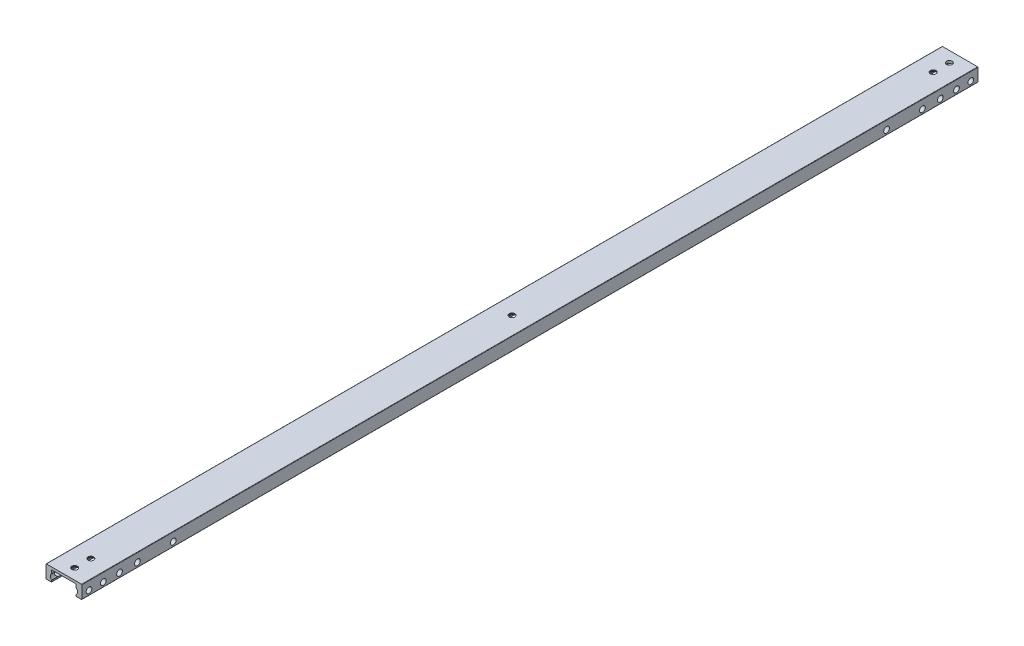
from build123d import *
from OCP.BRepFilletAPI import BRepFilletAPI_MakeChamfer

# Parameters (mm, degrees)
BOSS_EXTRUDE1_DEPTH     = 500
SKETCH4_R               = 1.6
CUT_EXTRUDE1_DEPTH      = 501.135981509
SKETCH5_R               = 1.9
CUT_EXTRUDE2_DEPTH      = 501.113677078
FILLET1_R               = 0.2
CUT_EXTRUDE3_DEPTH      = 501.297523979
CUT_EXTRUDE3_DEPTH_BACK = 501.297523979
SKETCH6_R               = 1.6
CHAMFER3_SIZE           = 1
CHAMFER3_SIZE2          = 0.965688775


with BuildPart() as part:
    # Sketch1 → Boss-Extrude1 (new body)
    with BuildSketch(Plane.XY):
        Polygon((-10, 3.7), (-10, -3.7), (-6.85, -3.7), (-6.85, 2.3), (6.85, 2.3), (6.85, -3.7), (10, -3.7), (10, 3.7), align=None)
    extrude(amount=BOSS_EXTRUDE1_DEPTH)

    # Sketch4 → Cut-Extrude1 (cut, through all)
    with BuildSketch(Plane.XZ.offset(-2.3)):
        with Locations((0, 250)):
            Circle(SKETCH4_R)
        with Locations((0, 15)):
            Circle(SKETCH4_R)
        with Locations(Location((0, 485, 0), (0, 0, 180))):
            Circle(SKETCH4_R)
        with Locations((0, 494)):
            Circle(SKETCH4_R)
        with Locations(Location((0, 6, 0), (0, 0, 180))):
            Circle(SKETCH4_R)
    extrude(amount=-CUT_EXTRUDE1_DEPTH, mode=Mode.SUBTRACT)

    # Sketch5 → Cut-Extrude2 (cut, through all)
    with BuildSketch(Plane.XY.offset(500)):
        with Locations((-5.729949702, -1.15)):
            Circle(SKETCH5_R)
        with Locations((5.729949702, -1.15)):
            Circle(SKETCH5_R)
    extrude(amount=-CUT_EXTRUDE2_DEPTH, mode=Mode.SUBTRACT)

    # Fillet1
    fillet1_edges = [part.edges().sort_by_distance(p)[0] for p in [
        (6.85, 2.3, 250),
        (-6.85, 2.3, 250),
        (-6.85, -3.7, 250),
        (-10, -3.7, 250),
        (-10, 3.7, 250),
        (10, 3.7, 250),
        (10, -3.7, 250),
        (6.85, -3.7, 250),
        (-6.85, -2.684759698, 250),
        (-6.85, 0.384759698, 250),
        (6.85, -2.684759698, 250),
        (6.85, 0.384759698, 250),
    ]]
    fillet(fillet1_edges, radius=FILLET1_R)

    # Sketch6 → Cut-Extrude3 (cut, two sides: drawn at the far end of the back side and taken through both)
    with BuildSketch(Plane(origin=(-6.85, 0, 0), x_dir=(0, 0, -1), z_dir=(1, 0, 0)).offset(-CUT_EXTRUDE3_DEPTH_BACK)):
        with Locations((-496, -1.15)):
            Circle(SKETCH6_R)
        with Locations(Location((-488, -1.15, 0), (0, 0, 67.451692584))):
            Circle(SKETCH6_R)
        with Locations((-12, -1.15)):
            Circle(SKETCH6_R)
        with Locations((-4, -1.15)):
            Circle(SKETCH6_R)
        with Locations((-469, -1.15)):
            Circle(SKETCH6_R)
        with Locations((-449, -1.15)):
            Circle(SKETCH6_R)
        with Locations((-479, -1.15)):
            Circle(SKETCH6_R)
        with Locations(Location((-51, -1.15, 0), (0, 0, 67.451692584))):
            Circle(SKETCH6_R)
        with Locations(Location((-31, -1.15, 0), (0, 0, 67.451692584))):
            Circle(SKETCH6_R)
        with Locations(Location((-21, -1.15, 0), (0, 0, 67.451692584))):
            Circle(SKETCH6_R)
    extrude(amount=CUT_EXTRUDE3_DEPTH + CUT_EXTRUDE3_DEPTH_BACK, mode=Mode.SUBTRACT)

    # Chamfer3: one chamfer whose edges measure the first distance from different faces: ONE call of the kernel's chamfer builder (chamfer() names one face for all edges)
    chamfer3_edges_1 = [part.edges().sort_by_distance(p)[0] for p in [
        (-1.6, 2.3, 15),
    ]]
    chamfer3_side_1 = [part.faces().sort_by_distance(p)[0] for p in [
        (-1.6, 3, 15),
    ]]
    chamfer3_edges_2 = [part.edges().sort_by_distance(p)[0] for p in [
        (1.6, 2.3, 485),
    ]]
    chamfer3_side_2 = [part.faces().sort_by_distance(p)[0] for p in [
        (1.6, 3, 485),
    ]]
    chamfer3_edges_3 = [part.edges().sort_by_distance(p)[0] for p in [
        (-1.6, 2.3, 494),
    ]]
    chamfer3_side_3 = [part.faces().sort_by_distance(p)[0] for p in [
        (-1.6, 3, 494),
    ]]
    chamfer3_edges_4 = [part.edges().sort_by_distance(p)[0] for p in [
        (-1.6, 2.3, 250),
    ]]
    chamfer3_side_4 = [part.faces().sort_by_distance(p)[0] for p in [
        (-1.6, 3, 250),
    ]]
    chamfer3 = BRepFilletAPI_MakeChamfer(part.part.solid().wrapped)
    for e in chamfer3_edges_1:
        chamfer3.Add(CHAMFER3_SIZE, CHAMFER3_SIZE2, e.wrapped, chamfer3_side_1[0].wrapped)  # the first distance lies on this face
    for e in chamfer3_edges_2:
        chamfer3.Add(CHAMFER3_SIZE, CHAMFER3_SIZE2, e.wrapped, chamfer3_side_2[0].wrapped)  # the first distance lies on this face
    for e in chamfer3_edges_3:
        chamfer3.Add(CHAMFER3_SIZE, CHAMFER3_SIZE2, e.wrapped, chamfer3_side_3[0].wrapped)  # the first distance lies on this face
    for e in chamfer3_edges_4:
        chamfer3.Add(CHAMFER3_SIZE, CHAMFER3_SIZE2, e.wrapped, chamfer3_side_4[0].wrapped)  # the first distance lies on this face
    add(Compound.cast(chamfer3.Shape()), mode=Mode.REPLACE)


solid = part.part
